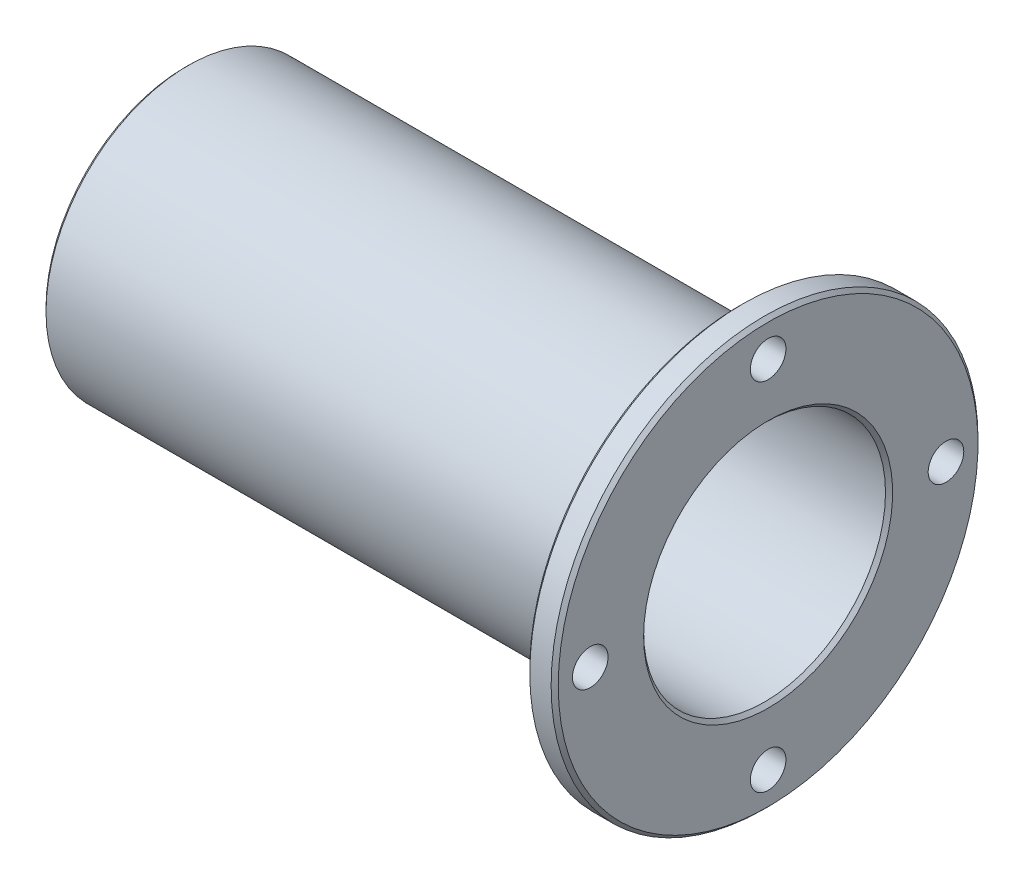
from build123d import *

# Parameters (mm, degrees)
CHANFREIN1_SIZE                                = 0.5
FRAISAGE_POUR_VIS_T_TE_FRAIS_E_M31_D           = 3.2
FRAISAGE_POUR_VIS_T_TE_FRAIS_E_M31_CSINK_D     = 7.3
FRAISAGE_POUR_VIS_T_TE_FRAIS_E_M31_CSINK_ANGLE = 90
ENL_V_MAT_EXTRU_1_REACH                        = 94.326
ESQUISSE5_R                                    = 2.5


with BuildPart() as part:
    # Esquisse1 → Révolution1 (revolve)
    with BuildSketch(Plane.XY, mode=Mode.PRIVATE) as r_volution1_sk:
        Polygon((0, 10), (0, 20), (78, 20), (78, 30), (82, 30), (82, 17), (4, 17), (4, 10), align=None)
    revolve(r_volution1_sk.sketch.rotate(Axis((0, 0, 0), (1, 0, 0)), 90), axis=Axis((0, 0, 0), (1, 0, 0)))

    # Chanfrein1
    chanfrein1_edges = [part.edges().sort_by_distance(p)[0] for p in [
        (0, 0, -20),
        (78, 0, -30),
        (82, 0, -30),
        (82, 0, -17),
        (4, 0, -10),
    ]]
    chamfer(chanfrein1_edges, length=CHANFREIN1_SIZE)

    # Fraisage pour vis à tête fraisée M31 (through all)
    with Locations(Plane.ZY):
        with Locations((0, 13), (13, 0), (0, -13), (-13, 0)):
            CounterSinkHole(FRAISAGE_POUR_VIS_T_TE_FRAIS_E_M31_D / 2, FRAISAGE_POUR_VIS_T_TE_FRAIS_E_M31_CSINK_D / 2, counter_sink_angle=FRAISAGE_POUR_VIS_T_TE_FRAIS_E_M31_CSINK_ANGLE)

    # Esquisse5 → Enlèv. mat.-Extru.1 (cut, up to next)
    with BuildSketch(Plane(origin=(82, 0, 0), x_dir=(0, 0, -1), z_dir=(1, 0, 0)), mode=Mode.PRIVATE) as enl_v_mat_extru_1_sk1:
        with Locations((0, 25)):
            Circle(ESQUISSE5_R)
    enl_v_mat_extru_1_tool1 = extrude(enl_v_mat_extru_1_sk1.sketch, amount=-ENL_V_MAT_EXTRU_1_REACH, mode=Mode.PRIVATE) & part.part
    # Esquisse5 → Enlèv. mat.-Extru.1 (cut, up to next)
    with BuildSketch(Plane(origin=(82, 0, 0), x_dir=(0, 0, -1), z_dir=(1, 0, 0)), mode=Mode.PRIVATE) as enl_v_mat_extru_1_sk2:
        with Locations((25, 0)):
            Circle(ESQUISSE5_R)
    enl_v_mat_extru_1_tool2 = extrude(enl_v_mat_extru_1_sk2.sketch, amount=-ENL_V_MAT_EXTRU_1_REACH, mode=Mode.PRIVATE) & part.part
    # Esquisse5 → Enlèv. mat.-Extru.1 (cut, up to next)
    with BuildSketch(Plane(origin=(82, 0, 0), x_dir=(0, 0, -1), z_dir=(1, 0, 0)), mode=Mode.PRIVATE) as enl_v_mat_extru_1_sk3:
        with Locations((-25, 0)):
            Circle(ESQUISSE5_R)
    enl_v_mat_extru_1_tool3 = extrude(enl_v_mat_extru_1_sk3.sketch, amount=-ENL_V_MAT_EXTRU_1_REACH, mode=Mode.PRIVATE) & part.part
    # Esquisse5 → Enlèv. mat.-Extru.1 (cut, up to next)
    with BuildSketch(Plane(origin=(82, 0, 0), x_dir=(0, 0, -1), z_dir=(1, 0, 0)), mode=Mode.PRIVATE) as enl_v_mat_extru_1_sk4:
        with Locations((0, -25)):
            Circle(ESQUISSE5_R)
    enl_v_mat_extru_1_tool4 = extrude(enl_v_mat_extru_1_sk4.sketch, amount=-ENL_V_MAT_EXTRU_1_REACH, mode=Mode.PRIVATE) & part.part
    add(enl_v_mat_extru_1_tool1.solids().sort_by_distance((82, 25, 0))[0], mode=Mode.SUBTRACT)
    add(enl_v_mat_extru_1_tool2.solids().sort_by_distance((82, 0, -25))[0], mode=Mode.SUBTRACT)
    add(enl_v_mat_extru_1_tool3.solids().sort_by_distance((82, 0, 25))[0], mode=Mode.SUBTRACT)
    add(enl_v_mat_extru_1_tool4.solids().sort_by_distance((82, -25, 0))[0], mode=Mode.SUBTRACT)


solid = part.part
